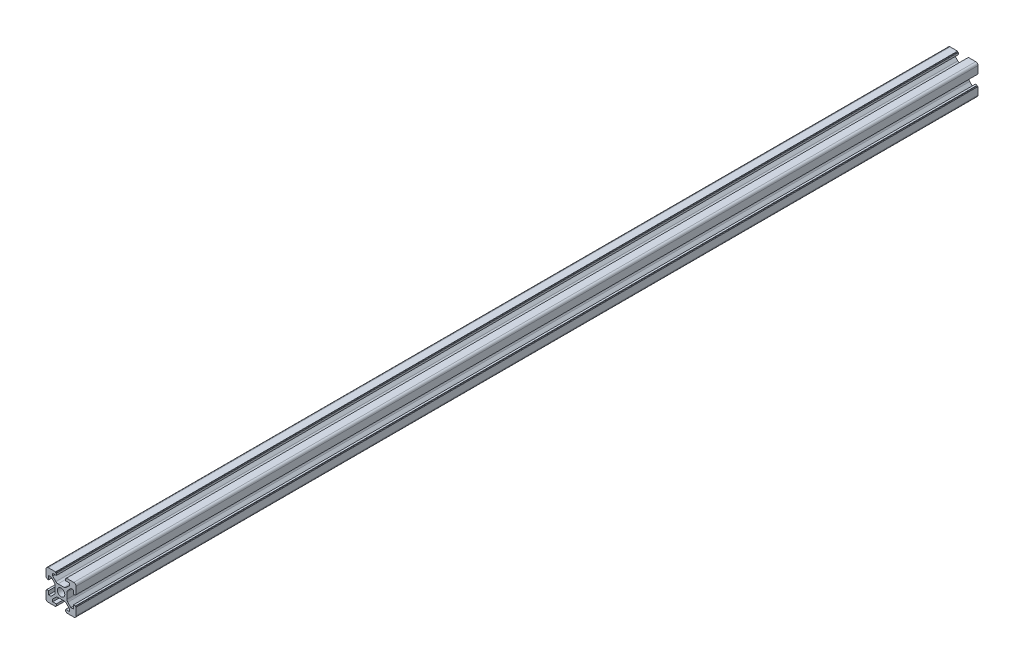
from build123d import *

# Parameters (mm, degrees)
SKETCH1_R      = 2.5
EXTRUDE1_DEPTH = 600


with BuildPart() as part:
    # Sketch1 → Extrude1 (new body)
    with BuildSketch(Plane.XY):
        with BuildLine():
            Line((0, 3.9), (-2.010912703, 3.9))
            ThreePointArc((-2.010912703, 3.9), (-2.776279568, 4.052240935), (-3.425126266, 4.485786438))
            Line((-3.425126266, 4.485786438), (-5.539339828, 6.6))
            Line((-5.539339828, 6.6), (-5.539339828, 8.2))
            Line((-5.539339828, 8.2), (-3.1, 8.2))
            Line((-3.1, 8.2), (-3.1, 9.5))
            Line((-3.1, 9.5), (-3.4, 9.5))
            ThreePointArc((-3.4, 9.5), (-3.541421356, 9.558578644), (-3.6, 9.7))
            Line((-3.6, 9.7), (-3.6, 10))
            Line((-3.6, 10), (-8.5, 10))
            ThreePointArc((-8.5, 10), (-9.560660172, 9.560660172), (-10, 8.5))
            Line((-10, 8.5), (-10, 3.6))
            Line((-10, 3.6), (-9.7, 3.6))
            ThreePointArc((-9.7, 3.6), (-9.558578644, 3.541421356), (-9.5, 3.4))
            Line((-9.5, 3.4), (-9.5, 3.1))
            Line((-9.5, 3.1), (-8.2, 3.1))
            Line((-8.2, 3.1), (-8.2, 5.539339828))
            Line((-8.2, 5.539339828), (-6.6, 5.539339828))
            Line((-6.6, 5.539339828), (-4.485786438, 3.425126266))
            ThreePointArc((-4.485786438, 3.425126266), (-4.052240935, 2.776279568), (-3.9, 2.010912703))
            Line((-3.9, 2.010912703), (-3.9, 0))
            Line((-3.9, 0), (-3.9, -2.010912703))
            ThreePointArc((-3.9, -2.010912703), (-4.052240935, -2.776279568), (-4.485786438, -3.425126266))
            Line((-4.485786438, -3.425126266), (-6.6, -5.539339828))
            Line((-6.6, -5.539339828), (-8.2, -5.539339828))
            Line((-8.2, -5.539339828), (-8.2, -3.1))
            Line((-8.2, -3.1), (-9.5, -3.1))
            Line((-9.5, -3.1), (-9.5, -3.4))
            ThreePointArc((-9.5, -3.4), (-9.558578644, -3.541421356), (-9.7, -3.6))
            Line((-9.7, -3.6), (-10, -3.6))
            Line((-10, -3.6), (-10, -8.5))
            ThreePointArc((-10, -8.5), (-9.560660172, -9.560660172), (-8.5, -10))
            Line((-8.5, -10), (-3.6, -10))
            Line((-3.6, -10), (-3.6, -9.7))
            ThreePointArc((-3.6, -9.7), (-3.541421356, -9.558578644), (-3.4, -9.5))
            Line((-3.4, -9.5), (-3.1, -9.5))
            Line((-3.1, -9.5), (-3.1, -8.2))
            Line((-3.1, -8.2), (-5.539339828, -8.2))
            Line((-5.539339828, -8.2), (-5.539339828, -6.6))
            Line((-5.539339828, -6.6), (-3.425126266, -4.485786438))
            ThreePointArc((-3.425126266, -4.485786438), (-2.776279568, -4.052240935), (-2.010912703, -3.9))
            Line((-2.010912703, -3.9), (0, -3.9))
            Line((0, -3.9), (2.010912703, -3.9))
            ThreePointArc((2.010912703, -3.9), (2.776279568, -4.052240935), (3.425126266, -4.485786438))
            Line((3.425126266, -4.485786438), (5.539339828, -6.6))
            Line((5.539339828, -6.6), (5.539339828, -8.2))
            Line((5.539339828, -8.2), (3.1, -8.2))
            Line((3.1, -8.2), (3.1, -9.5))
            Line((3.1, -9.5), (3.4, -9.5))
            ThreePointArc((3.4, -9.5), (3.541421356, -9.558578644), (3.6, -9.7))
            Line((3.6, -9.7), (3.6, -10))
            Line((3.6, -10), (8.5, -10))
            ThreePointArc((8.5, -10), (9.560660172, -9.560660172), (10, -8.5))
            Line((10, -8.5), (10, -3.6))
            Line((10, -3.6), (9.7, -3.6))
            ThreePointArc((9.7, -3.6), (9.558578644, -3.541421356), (9.5, -3.4))
            Line((9.5, -3.4), (9.5, -3.1))
            Line((9.5, -3.1), (8.2, -3.1))
            Line((8.2, -3.1), (8.2, -5.539339828))
            Line((8.2, -5.539339828), (6.6, -5.539339828))
            Line((6.6, -5.539339828), (4.485786438, -3.425126266))
            ThreePointArc((4.485786438, -3.425126266), (4.052240935, -2.776279568), (3.9, -2.010912703))
            Line((3.9, -2.010912703), (3.9, 0))
            Line((3.9, 0), (3.9, 2.010912703))
            ThreePointArc((3.9, 2.010912703), (4.052240935, 2.776279568), (4.485786438, 3.425126266))
            Line((4.485786438, 3.425126266), (6.6, 5.539339828))
            Line((6.6, 5.539339828), (8.2, 5.539339828))
            Line((8.2, 5.539339828), (8.2, 3.1))
            Line((8.2, 3.1), (9.5, 3.1))
            Line((9.5, 3.1), (9.5, 3.4))
            ThreePointArc((9.5, 3.4), (9.558578644, 3.541421356), (9.7, 3.6))
            Line((9.7, 3.6), (10, 3.6))
            Line((10, 3.6), (10, 8.5))
            ThreePointArc((10, 8.5), (9.560660172, 9.560660172), (8.5, 10))
            Line((8.5, 10), (3.6, 10))
            Line((3.6, 10), (3.6, 9.7))
            ThreePointArc((3.6, 9.7), (3.541421356, 9.558578644), (3.4, 9.5))
            Line((3.4, 9.5), (3.1, 9.5))
            Line((3.1, 9.5), (3.1, 8.2))
            Line((3.1, 8.2), (5.539339828, 8.2))
            Line((5.539339828, 8.2), (5.539339828, 6.6))
            Line((5.539339828, 6.6), (3.425126266, 4.485786438))
            ThreePointArc((3.425126266, 4.485786438), (2.776279568, 4.052240935), (2.010912703, 3.9))
            Line((2.010912703, 3.9), (0, 3.9))
        make_face()
        Circle(SKETCH1_R, mode=Mode.SUBTRACT)
    extrude(amount=EXTRUDE1_DEPTH)


solid = part.part
